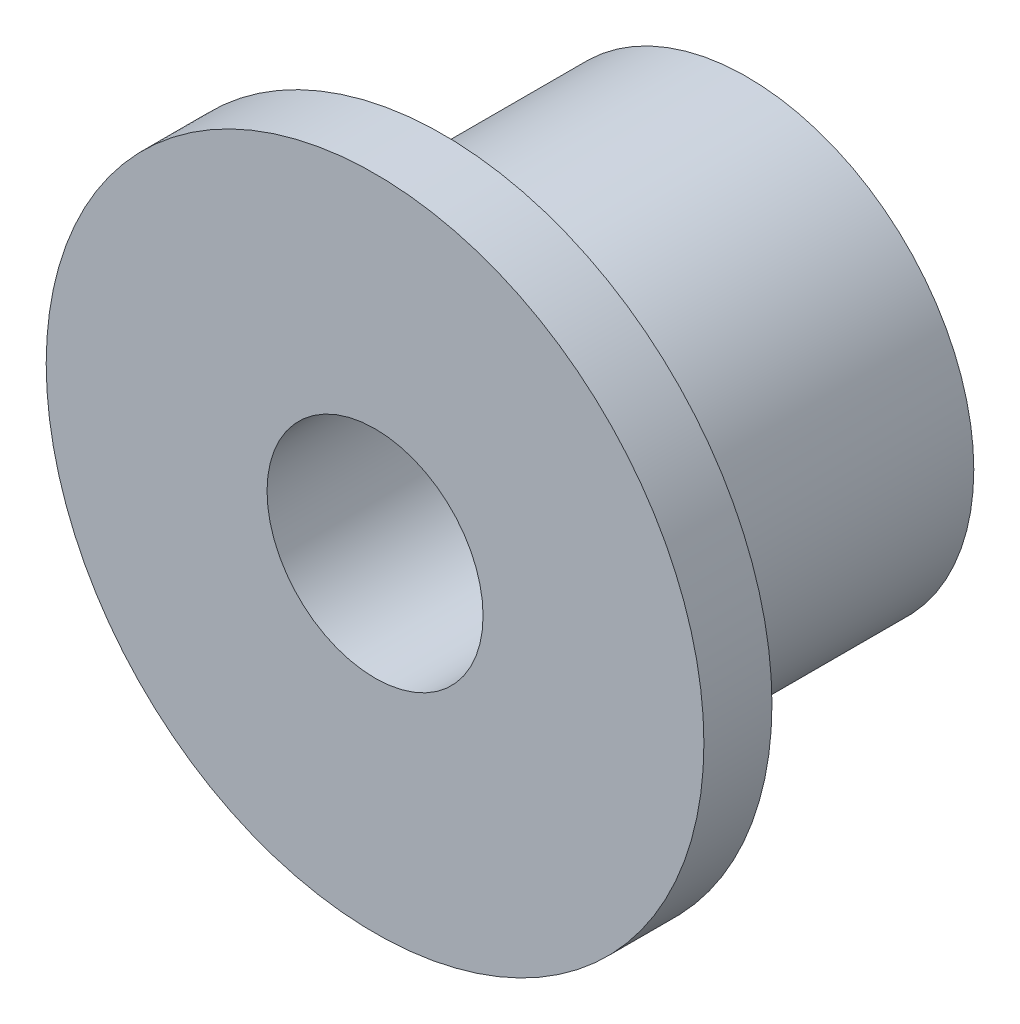
from build123d import *

# Parameters (mm, degrees)
SKETCH1_R               = 10
BOSS_EXTRUDE1_DEPTH     = 13.4
SKETCH2_R               = 14.5
BOSS_EXTRUDE2_DEPTH     = 3
SKETCH3_R               = 4.7625
CUT_EXTRUDE1_DEPTH      = 16.4
CUT_EXTRUDE2_REACH      = 28.258
CUT_EXTRUDE2_END_RADIUS = 10
SKETCH4_R               = 1.89865


with BuildPart() as part:
    # Sketch1 → Boss-Extrude1 (new body)
    with BuildSketch(Plane.XY):
        Circle(SKETCH1_R)
    extrude(amount=BOSS_EXTRUDE1_DEPTH)

    # Sketch2 → Boss-Extrude2 (add)
    with BuildSketch(Plane.XY.offset(13.4)):
        Circle(SKETCH2_R)
    extrude(amount=BOSS_EXTRUDE2_DEPTH)

    # Sketch3 → Cut-Extrude1 (cut)
    with BuildSketch(Plane.XY.offset(16.4)):
        Circle(SKETCH3_R)
    extrude(amount=-CUT_EXTRUDE1_DEPTH, mode=Mode.SUBTRACT)

    # Cut-Extrude2: up to this cylinder (the profile starts inside it)
    cut_extrude2_end = Plane(origin=(0, 0, 5), z_dir=(0, 0, -1)) * Cylinder(CUT_EXTRUDE2_END_RADIUS, 77.516, mode=Mode.PRIVATE)
    # Sketch4 → Cut-Extrude2 (cut, up to the surface)
    with BuildSketch(Plane(origin=(0, 0, 0), x_dir=(0, 0, -1), z_dir=(1, 0, 0)), mode=Mode.PRIVATE) as cut_extrude2_sk1:
        with Locations((-5, 0)):
            Circle(SKETCH4_R)
    cut_extrude2_tool1 = extrude(cut_extrude2_sk1.sketch, amount=-CUT_EXTRUDE2_REACH, mode=Mode.PRIVATE) & cut_extrude2_end
    add(cut_extrude2_tool1.solids().sort_by_distance((0, 0, 5))[0], mode=Mode.SUBTRACT)


solid = part.part
